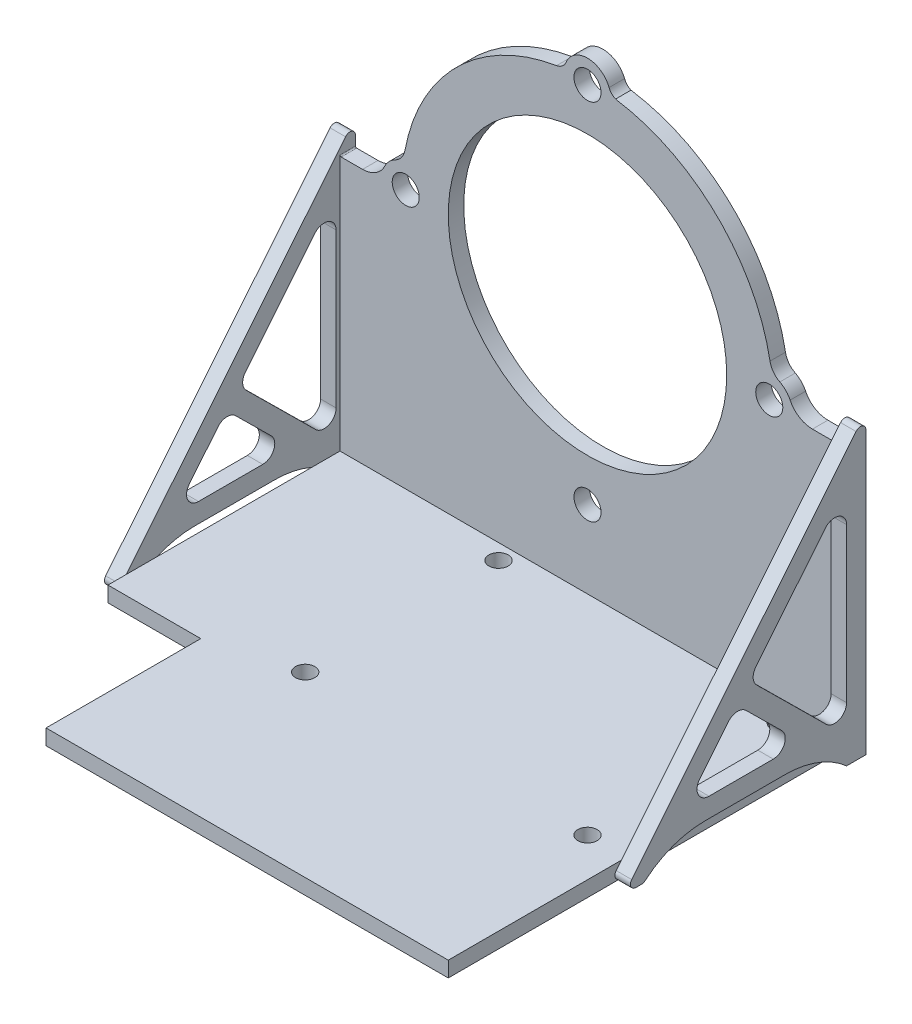
from build123d import *

# Parameters (mm, degrees)
BOSS_EXTRUDE1_DEPTH = 6.35
SKETCH3_W           = 203.2
SKETCH3_H           = 190.5
BOSS_EXTRUDE2_DEPTH = 6.35
SKETCH4_R           = 57.15
CUT_EXTRUDE1_DEPTH  = 6.35
SKETCH5_R           = 5.55625
CUT_EXTRUDE2_DEPTH  = 6.35
CUT_EXTRUDE3_DEPTH  = 6.35
SKETCH7_R           = 3.96875
CUT_EXTRUDE4_DEPTH  = 6.35
BOSS_EXTRUDE3_DEPTH = 6.35
BOSS_EXTRUDE4_DEPTH = 6.35
CUT_EXTRUDE5_DEPTH  = 6.35
CUT_EXTRUDE6_START  = -6.35
CUT_EXTRUDE6_DEPTH  = 6.35
CUT_EXTRUDE7_DEPTH  = 336.590140648
FILLET1_R           = 4.92
FILLET4_R           = 2.286
FILLET6_R           = 0.508


with BuildPart() as part:
    # Sketch2 → Boss-Extrude1 (new body)
    with BuildSketch(Plane(origin=(0, 0, 0), x_dir=(1, 0, 0), z_dir=(0, 1, 0))):
        Polygon((0, 0), (0, -101.6), (38.1, -101.6), (38.1, -165.1), (203.2, -165.1), (203.2, 0), align=None)
    extrude(amount=BOSS_EXTRUDE1_DEPTH)

    # Sketch3 → Boss-Extrude2 (add)
    with BuildSketch(Plane.XY):
        with Locations((101.6, 101.6)):
            Rectangle(SKETCH3_W, SKETCH3_H)
    extrude(amount=BOSS_EXTRUDE2_DEPTH)

    # Sketch4 → Cut-Extrude1 (cut)
    with BuildSketch(Plane.XY.offset(6.35)):
        with Locations((101.6, 112.7125)):
            Circle(SKETCH4_R)
    extrude(amount=-CUT_EXTRUDE1_DEPTH, mode=Mode.SUBTRACT)

    # Sketch5 → Cut-Extrude2 (cut)
    with BuildSketch(Plane(origin=(0, 0, 0), x_dir=(-1, 0, 0), z_dir=(0, 0, -1))):
        with Locations((-101.6, 38.1)):
            Circle(SKETCH5_R)
        with Locations((-101.6, 187.325)):
            Circle(SKETCH5_R)
        with Locations((-26.9875, 112.7125)):
            Circle(SKETCH5_R)
        with Locations((-176.2125, 112.7125)):
            Circle(SKETCH5_R)
    extrude(amount=-CUT_EXTRUDE2_DEPTH, mode=Mode.SUBTRACT)

    # Sketch6 → Cut-Extrude3 (cut)
    with BuildSketch(Plane(origin=(0, 0, 0), x_dir=(-1, 0, 0), z_dir=(0, 0, -1))):
        with BuildLine():
            Line((0, 111.125), (-9.267131247, 111.125))
            ThreePointArc((-9.267131247, 111.125), (-14.664932472, 112.677483405), (-18.413128023, 116.860483871))
            ThreePointArc((-18.413128023, 116.860483871), (-20.178261221, 119.372822234), (-22.650960402, 121.193068926))
            ThreePointArc((-22.650960402, 121.193068926), (-25.290856048, 123.423079717), (-26.674298839, 126.589794607))
            ThreePointArc((-26.674298839, 126.589794607), (-48.154578398, 167.02665018), (-88.932492132, 187.852198192))
            ThreePointArc((-88.932492132, 187.852198192), (-91.207894338, 188.852445809), (-92.736404121, 190.812447935))
            ThreePointArc((-92.736404121, 190.812447935), (-101.6, 196.85), (-110.463595879, 190.812447935))
            ThreePointArc((-110.463595879, 190.812447935), (-111.514959841, 189.166103939), (-113.109851938, 188.038214788))
            ThreePointArc((-113.109851938, 188.038214788), (-154.625968125, 167.436230725), (-176.525701161, 126.589794607))
            ThreePointArc((-176.525701161, 126.589794607), (-177.909143952, 123.423079717), (-180.549039598, 121.193068926))
            ThreePointArc((-180.549039598, 121.193068926), (-183.021738779, 119.372822234), (-184.786871977, 116.860483871))
            ThreePointArc((-184.786871977, 116.860483871), (-188.535067528, 112.677483405), (-193.932868753, 111.125))
            Line((-193.932868753, 111.125), (-203.2, 111.125))
            Line((-203.2, 111.125), (-224.605111479, 111.125))
            Line((-224.605111479, 111.125), (-224.605111479, 212.995219786))
            Line((-224.605111479, 212.995219786), (24.443830007, 212.995219786))
            Line((24.443830007, 212.995219786), (24.443830007, 111.125))
            Line((24.443830007, 111.125), (0, 111.125))
        make_face()
    extrude(amount=-CUT_EXTRUDE3_DEPTH, mode=Mode.SUBTRACT)

    # Sketch7 → Cut-Extrude4 (cut)
    with BuildSketch(Plane(origin=(0, 6.35, 0), x_dir=(1, 0, 0), z_dir=(0, 1, 0))):
        with Locations(Location((187.325, -92.075, 0), (0, 0, 270))):
            Circle(SKETCH7_R)
        with Locations(Location((187.325, -12.7, 0), (0, 0, 270))):
            Circle(SKETCH7_R)
        with Locations(Location((71.4375, -12.7, 0), (0, 0, 270))):
            Circle(SKETCH7_R)
        with Locations(Location((71.4375, -92.075, 0), (0, 0, 270))):
            Circle(SKETCH7_R)
    extrude(amount=-CUT_EXTRUDE4_DEPTH, mode=Mode.SUBTRACT)

    # Sketch8 → Boss-Extrude3 (add)
    with BuildSketch(Plane(origin=(0, 0, 0), x_dir=(0, 0, -1), z_dir=(1, 0, 0))):
        Polygon((0, 0), (-99.21875, 0), (0, 121.92), align=None)
    extrude(amount=-BOSS_EXTRUDE3_DEPTH)

    # Sketch10 → Boss-Extrude4 (add)
    with BuildSketch(Plane(origin=(203.2, 0, 0), x_dir=(0, 0, -1), z_dir=(1, 0, 0))):
        Polygon((-99.21875, 0), (0, 0), (0, 121.92), align=None)
    extrude(amount=BOSS_EXTRUDE4_DEPTH)

    # Sketch11 → Cut-Extrude5 (cut)
    with BuildSketch(Plane(origin=(209.55, 0, 0), x_dir=(0, 0, -1), z_dir=(1, 0, 0))):
        with BuildLine():
            Line((-7.9375, 0), (-91.28125, 0))
            ThreePointArc((-91.28125, 0), (-79.550852944, 7.064286609), (-66.080468762, 9.525))
            Line((-66.080468762, 9.525), (-33.138281238, 9.525))
            ThreePointArc((-33.138281238, 9.525), (-19.667897056, 7.064286609), (-7.9375, 0))
        make_face()
    extrude(amount=-CUT_EXTRUDE5_DEPTH, mode=Mode.SUBTRACT)

    # Sketch12 → Cut-Extrude6 (cut)
    with BuildSketch(Plane.ZY.offset(6.35).offset(CUT_EXTRUDE6_START)):
        with BuildLine():
            Line((91.28125, 0), (7.9375, 0))
            ThreePointArc((7.9375, 0), (19.667897056, 7.064286609), (33.138281238, 9.525))
            Line((33.138281238, 9.525), (66.080468762, 9.525))
            ThreePointArc((66.080468762, 9.525), (79.550852944, 7.064286609), (91.28125, 0))
        make_face()
    extrude(amount=CUT_EXTRUDE6_DEPTH, mode=Mode.SUBTRACT)

    # Sketch13 → Cut-Extrude7 (cut, through all)
    with BuildSketch(Plane(origin=(209.55, 0, 0), x_dir=(0, 0, -1), z_dir=(1, 0, 0))):
        Polygon((-7.9375, 99.591161664), (-7.9375, 10.691161664), (-48.018748286, 50.339323771), align=None)
        Polygon((-53.052501721, 44.153847549), (-26.069598319, 17.4625), (-74.773975963, 17.4625), align=None)
    extrude(amount=-CUT_EXTRUDE7_DEPTH, mode=Mode.SUBTRACT)

    # Fillet1
    fillet1_edges = [part.edges().sort_by_distance(p)[0] for p in [
        (206.375, 50.339323771, 48.018748286),
        (-3.175, 50.339323771, 48.018748286),
        (206.375, 99.591161664, 7.9375),
        (-3.175, 99.591161664, 7.9375),
        (206.375, 10.691161664, 7.9375),
        (-3.175, 10.691161664, 7.9375),
        (206.375, 44.153847549, 53.052501721),
        (-3.175, 44.153847549, 53.052501721),
        (206.375, 17.4625, 26.069598319),
        (-3.175, 17.4625, 26.069598319),
        (206.375, 17.4625, 74.773975963),
        (-3.175, 17.4625, 74.773975963),
    ]]
    fillet(fillet1_edges, radius=FILLET1_R)

    # Fillet4
    fillet4_edges = [part.edges().sort_by_distance(p)[0] for p in [
        (-3.175, 121.92, 0),
        (-3.175, 0, 99.21875),
        (206.375, 121.92, 0),
        (206.375, 0, 99.21875),
        (206.375, 0, 91.28125),
        (-3.175, 0, 91.28125),
    ]]
    fillet(fillet4_edges, radius=FILLET4_R)

    # Fillet6
    fillet6_edges = [part.edges().sort_by_distance(p)[0] for p in [
        (0, 111.125, 3.175),
    ]]
    fillet(fillet6_edges, radius=FILLET6_R)


solid = part.part
